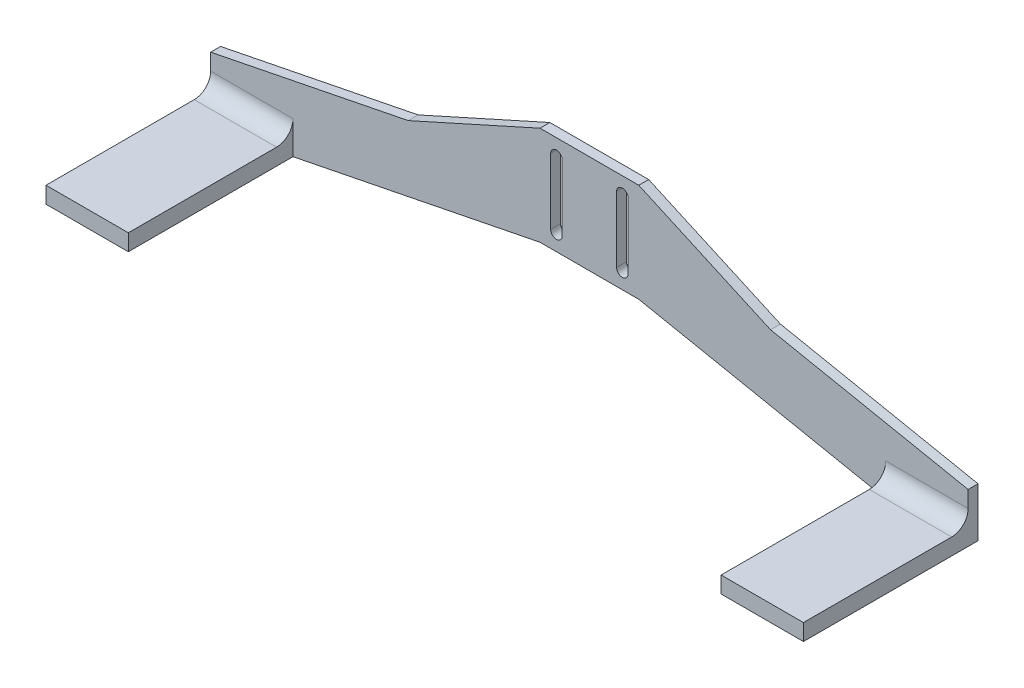
from build123d import *

# Parameters (mm, degrees)
SKETCH_1_W      = 30
SKETCH_1_H      = 30
EXTRUDE_1_DEPTH = 3
EXTRUDE_START   = -3
SKETCH_2_W      = 25
SKETCH_2_H      = 5
EXTRUDE_2_DEPTH = 50
FILLET_1_R      = 5


with BuildPart() as part:
    # 草图1 → 凸台-拉伸1 (new body)
    # profile 1 of 3: a face of its own
    with BuildSketch(Plane.XY):
        Polygon((15, 15), (15, -15), (90, -30), (115, -30), (115, -15), (55, -3), align=None)
    # profile 2 of 3: a face of its own
    with BuildSketch(Plane.XY):
        Rectangle(SKETCH_1_W, SKETCH_1_H)
        with BuildLine():
            Line((-11.75, -10), (-11.75, 10))
            ThreePointArc((-11.75, 10), (-10, 11.75), (-8.25, 10))
            Line((-8.25, 10), (-8.25, -10))
            ThreePointArc((-8.25, -10), (-10, -11.75), (-11.75, -10))
        make_face(mode=Mode.SUBTRACT)
        with BuildLine():
            ThreePointArc((8.25, 10), (10, 11.75), (11.75, 10))
            Line((11.75, 10), (11.75, -10))
            ThreePointArc((11.75, -10), (10, -11.75), (8.25, -10))
            Line((8.25, -10), (8.25, 10))
        make_face(mode=Mode.SUBTRACT)
    # profile 3 of 3: a face of its own
    with BuildSketch(Plane.XY):
        Polygon((-55, -3), (-15, 15), (-15, -15), (-90, -30), (-115, -30), (-115, -15), align=None)
    extrude(amount=EXTRUDE_1_DEPTH)

    # 草图2 → 凸台-拉伸2 (add)
    with BuildSketch(Plane(origin=(0, 0, 0), x_dir=(-1, 0, 0), z_dir=(0, 0, -1)).offset(EXTRUDE_START)):
        with Locations((-102.5, -27.5)):
            Rectangle(SKETCH_2_W, SKETCH_2_H)
        with Locations((102.5, -27.5)):
            Rectangle(SKETCH_2_W, SKETCH_2_H)
    extrude(amount=-EXTRUDE_2_DEPTH)

    # 圆角1
    fillet_1_edges = [part.edges().sort_by_distance(p)[0] for p in [
        (102.5, -25, 3),
        (-102.5, -25, 3),
    ]]
    fillet(fillet_1_edges, radius=FILLET_1_R)


solid = part.part
